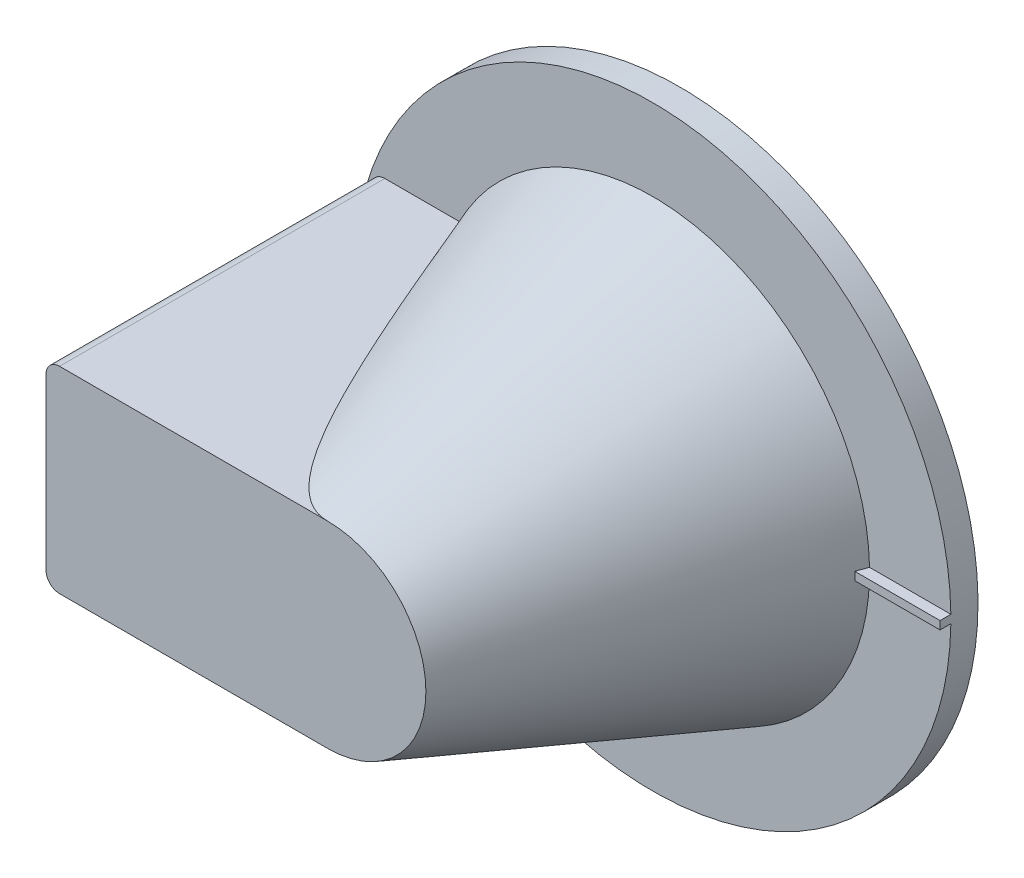
from build123d import *
from OCP.BRepFilletAPI import BRepFilletAPI_MakeChamfer

# Parameters (mm, degrees)
SKETCH1_R                 = 11
BOSS_EXTRUDE1_DEPTH       = 1
SKETCH2_R                 = 8
BOSS_EXTRUDE2_DEPTH       = 12
BOSS_EXTRUDE2_TAPER       = 20
BOSS_EXTRUDE3_REACH       = 22.273
INDICADOR_SELECCION_DEPTH = 0.4
CUT_EXTRUDE1_DEPTH        = 8
SKETCH6_R                 = 3.5
CUT_EXTRUDE2_DEPTH        = 0.6
CHAMFER1_SIZE             = 0.5
CHAMFER1_SIZE2            = 0.288675135


with BuildPart() as part:
    # Sketch1 → Boss-Extrude1 (new body)
    with BuildSketch(Plane.XY):
        Circle(SKETCH1_R)
    extrude(amount=BOSS_EXTRUDE1_DEPTH)

    # Sketch2 → Boss-Extrude2 (add)
    with BuildSketch(Plane.XY.offset(1)):
        Circle(SKETCH2_R)
    extrude(amount=BOSS_EXTRUDE2_DEPTH, taper=BOSS_EXTRUDE2_TAPER)

    # Sketch3 → Boss-Extrude3 (add, up to next)
    with BuildSketch(Plane.XY.offset(13), mode=Mode.PRIVATE) as boss_extrude3_sk1:
        with BuildLine():
            Line((0, 3.632357189), (-9.882965918, 3.632357189))
            ThreePointArc((-9.882965918, 3.632357189), (-10.236519309, 3.485910579), (-10.382965918, 3.132357189))
            Line((-10.382965918, 3.132357189), (-10.382965918, -3.132357189))
            ThreePointArc((-10.382965918, -3.132357189), (-10.236519309, -3.485910579), (-9.882965918, -3.632357189))
            Line((-9.882965918, -3.632357189), (0, -3.632357189))
            ThreePointArc((0, -3.632357189), (3.632357189, 0), (0, 3.632357189))
        make_face()
    boss_extrude3_tool1 = extrude(boss_extrude3_sk1.sketch, amount=-BOSS_EXTRUDE3_REACH, mode=Mode.PRIVATE) - part.part
    add(boss_extrude3_tool1.solids().sort_by_distance((-3.732934, 0, 13))[0])

    # Sketch4 → Indicador Seleccion (add)
    with BuildSketch(Plane.XY.offset(1)):
        with BuildLine():
            ThreePointArc((7.998593626, -0.15), (8, 0), (7.998593626, 0.15))
            Line((7.998593626, 0.15), (7.49849985, 0.15))
            ThreePointArc((7.49849985, 0.15), (7.5, 0), (7.49849985, -0.15))
            Line((7.49849985, -0.15), (7.998593626, -0.15))
        make_face()
        with BuildLine():
            ThreePointArc((11, 0), (10.999744303, 0.075001743), (10.998977225, 0.15))
            Line((10.998977225, 0.15), (7.998593626, 0.15))
            ThreePointArc((7.998593626, 0.15), (8, 0), (7.998593626, -0.15))
            Line((7.998593626, -0.15), (10.998977225, -0.15))
            ThreePointArc((10.998977225, -0.15), (10.999744303, -0.075001743), (11, 0))
        make_face()
    extrude(amount=INDICADOR_SELECCION_DEPTH)

    # Sketch5 → Cut-Extrude1 (cut)
    with BuildSketch(Plane(origin=(0, 0, 0), x_dir=(-1, 0, 0), z_dir=(0, 0, -1))):
        with BuildLine():
            ThreePointArc((-1.941278917, 1.947802907), (-2.106622219, 1.767665927), (-2.255310951, 1.573554103))
            ThreePointArc((-2.255310951, 1.573554103), (-2.663028117, 1.5375), (-2.490393303, 1.166379525))
            ThreePointArc((-2.490393303, 1.166379525), (-2.584154707, 0.940555394), (-2.657486258, 0.707295405))
            ThreePointArc((-2.657486258, 0.707295405), (-3.028283841, 0.533968146), (-2.739129502, 0.244273558))
            ThreePointArc((-2.739129502, 0.244273558), (-2.75, 0), (-2.739129502, -0.244273558))
            ThreePointArc((-2.739129502, -0.244273558), (-3.028283841, -0.533968146), (-2.657486258, -0.707295405))
            ThreePointArc((-2.657486258, -0.707295405), (-2.584154707, -0.940555394), (-2.490393303, -1.166379525))
            ThreePointArc((-2.490393303, -1.166379525), (-2.663028117, -1.5375), (-2.255310951, -1.573554103))
            ThreePointArc((-2.255310951, -1.573554103), (-2.106622219, -1.767665927), (-1.941278917, -1.947802907))
            ThreePointArc((-1.941278917, -1.947802907), (-1.9765719, -2.355586663), (-1.581111858, -2.250018954))
            ThreePointArc((-1.581111858, -2.250018954), (-1.375, -2.38156986), (-1.158017644, -2.494292512))
            ThreePointArc((-1.158017644, -2.494292512), (-1.051711941, -2.889554809), (-0.71620734, -2.655098312))
            ThreePointArc((-0.71620734, -2.655098312), (-0.477532489, -2.708221321), (-0.235082352, -2.739933628))
            ThreePointArc((-0.235082352, -2.739933628), (0, -3.075), (0.235082352, -2.739933628))
            ThreePointArc((0.235082352, -2.739933628), (0.477532489, -2.708221321), (0.71620734, -2.655098312))
            ThreePointArc((0.71620734, -2.655098312), (1.051711941, -2.889554809), (1.158017644, -2.494292512))
            ThreePointArc((1.158017644, -2.494292512), (1.375, -2.38156986), (1.581111858, -2.250018954))
            ThreePointArc((1.581111858, -2.250018954), (1.9765719, -2.355586663), (1.941278917, -1.947802907))
            ThreePointArc((1.941278917, -1.947802907), (2.106622219, -1.767665927), (2.255310951, -1.573554103))
            ThreePointArc((2.255310951, -1.573554103), (2.663028117, -1.5375), (2.490393303, -1.166379525))
            ThreePointArc((2.490393303, -1.166379525), (2.584154707, -0.940555394), (2.657486258, -0.707295405))
            ThreePointArc((2.657486258, -0.707295405), (3.028283841, -0.533968146), (2.739129502, -0.244273558))
            ThreePointArc((2.739129502, -0.244273558), (2.75, 0), (2.739129502, 0.244273558))
            ThreePointArc((2.739129502, 0.244273558), (3.028283841, 0.533968146), (2.657486258, 0.707295405))
            ThreePointArc((2.657486258, 0.707295405), (2.584154707, 0.940555394), (2.490393303, 1.166379525))
            ThreePointArc((2.490393303, 1.166379525), (2.663028117, 1.5375), (2.255310951, 1.573554103))
            ThreePointArc((2.255310951, 1.573554103), (2.106622219, 1.767665927), (1.941278917, 1.947802907))
            ThreePointArc((1.941278917, 1.947802907), (1.9765719, 2.355586663), (1.581111858, 2.250018954))
            ThreePointArc((1.581111858, 2.250018954), (1.375, 2.38156986), (1.158017644, 2.494292512))
            ThreePointArc((1.158017644, 2.494292512), (1.051711941, 2.889554809), (0.71620734, 2.655098312))
            ThreePointArc((0.71620734, 2.655098312), (0.477532489, 2.708221321), (0.235082352, 2.739933628))
            ThreePointArc((0.235082352, 2.739933628), (0, 3.075), (-0.235082352, 2.739933628))
            ThreePointArc((-0.235082352, 2.739933628), (-0.477532489, 2.708221321), (-0.71620734, 2.655098312))
            ThreePointArc((-0.71620734, 2.655098312), (-1.051711941, 2.889554809), (-1.158017644, 2.494292512))
            ThreePointArc((-1.158017644, 2.494292512), (-1.375, 2.38156986), (-1.581111858, 2.250018954))
            ThreePointArc((-1.581111858, 2.250018954), (-1.9765719, 2.355586663), (-1.941278917, 1.947802907))
        make_face()
    extrude(amount=-CUT_EXTRUDE1_DEPTH, mode=Mode.SUBTRACT)

    # Sketch6 → Cut-Extrude2 (cut)
    with BuildSketch(Plane(origin=(0, 0, 0), x_dir=(-1, 0, 0), z_dir=(0, 0, -1))):
        Circle(SKETCH6_R)
    extrude(amount=-CUT_EXTRUDE2_DEPTH, mode=Mode.SUBTRACT)

    # Chamfer1: one chamfer whose edges measure the first distance from different faces: ONE call of the kernel's chamfer builder (chamfer() names one face for all edges)
    chamfer1_edges_1 = [part.edges().sort_by_distance(p)[0] for p in [
        (2.106622219, 1.767665927, 0.6),
    ]]
    chamfer1_side_1 = [part.faces().sort_by_distance(p)[0] for p in [
        (2.106622219, 1.767665927, 4.3),
    ]]
    chamfer1_edges_2 = [part.edges().sort_by_distance(p)[0] for p in [
        (1.375, 2.38156986, 0.6),
    ]]
    chamfer1_side_2 = [part.faces().sort_by_distance(p)[0] for p in [
        (1.375, 2.38156986, 4.3),
    ]]
    chamfer1_edges_3 = [part.edges().sort_by_distance(p)[0] for p in [
        (0.477532489, 2.708221321, 0.6),
    ]]
    chamfer1_side_3 = [part.faces().sort_by_distance(p)[0] for p in [
        (0.477532489, 2.708221321, 4.3),
    ]]
    chamfer1_edges_4 = [part.edges().sort_by_distance(p)[0] for p in [
        (-0.477532489, 2.708221321, 0.6),
    ]]
    chamfer1_side_4 = [part.faces().sort_by_distance(p)[0] for p in [
        (-0.477532489, 2.708221321, 4.3),
    ]]
    chamfer1_edges_5 = [part.edges().sort_by_distance(p)[0] for p in [
        (-1.375, 2.38156986, 0.6),
    ]]
    chamfer1_side_5 = [part.faces().sort_by_distance(p)[0] for p in [
        (-1.375, 2.38156986, 4.3),
    ]]
    chamfer1_edges_6 = [part.edges().sort_by_distance(p)[0] for p in [
        (-2.106622219, 1.767665927, 0.6),
    ]]
    chamfer1_side_6 = [part.faces().sort_by_distance(p)[0] for p in [
        (-2.106622219, 1.767665927, 4.3),
    ]]
    chamfer1_edges_7 = [part.edges().sort_by_distance(p)[0] for p in [
        (-2.584154707, 0.940555394, 0.6),
    ]]
    chamfer1_side_7 = [part.faces().sort_by_distance(p)[0] for p in [
        (-2.584154707, 0.940555394, 4.3),
    ]]
    chamfer1_edges_8 = [part.edges().sort_by_distance(p)[0] for p in [
        (-2.75, 0, 0.6),
    ]]
    chamfer1_side_8 = [part.faces().sort_by_distance(p)[0] for p in [
        (-2.75, 0, 4.3),
    ]]
    chamfer1_edges_9 = [part.edges().sort_by_distance(p)[0] for p in [
        (-2.584154707, -0.940555394, 0.6),
    ]]
    chamfer1_side_9 = [part.faces().sort_by_distance(p)[0] for p in [
        (-2.584154707, -0.940555394, 4.3),
    ]]
    chamfer1_edges_10 = [part.edges().sort_by_distance(p)[0] for p in [
        (-2.106622219, -1.767665927, 0.6),
    ]]
    chamfer1_side_10 = [part.faces().sort_by_distance(p)[0] for p in [
        (-2.106622219, -1.767665927, 4.3),
    ]]
    chamfer1_edges_11 = [part.edges().sort_by_distance(p)[0] for p in [
        (-1.375, -2.38156986, 0.6),
    ]]
    chamfer1_side_11 = [part.faces().sort_by_distance(p)[0] for p in [
        (-1.375, -2.38156986, 4.3),
    ]]
    chamfer1_edges_12 = [part.edges().sort_by_distance(p)[0] for p in [
        (-0.477532489, -2.708221321, 0.6),
    ]]
    chamfer1_side_12 = [part.faces().sort_by_distance(p)[0] for p in [
        (-0.477532489, -2.708221321, 4.3),
    ]]
    chamfer1_edges_13 = [part.edges().sort_by_distance(p)[0] for p in [
        (0.477532489, -2.708221321, 0.6),
    ]]
    chamfer1_side_13 = [part.faces().sort_by_distance(p)[0] for p in [
        (0.477532489, -2.708221321, 4.3),
    ]]
    chamfer1_edges_14 = [part.edges().sort_by_distance(p)[0] for p in [
        (1.375, -2.38156986, 0.6),
    ]]
    chamfer1_side_14 = [part.faces().sort_by_distance(p)[0] for p in [
        (1.375, -2.38156986, 4.3),
    ]]
    chamfer1_edges_15 = [part.edges().sort_by_distance(p)[0] for p in [
        (2.106622219, -1.767665927, 0.6),
    ]]
    chamfer1_side_15 = [part.faces().sort_by_distance(p)[0] for p in [
        (2.106622219, -1.767665927, 4.3),
    ]]
    chamfer1_edges_16 = [part.edges().sort_by_distance(p)[0] for p in [
        (2.584154707, -0.940555394, 0.6),
    ]]
    chamfer1_side_16 = [part.faces().sort_by_distance(p)[0] for p in [
        (2.584154707, -0.940555394, 4.3),
    ]]
    chamfer1_edges_17 = [part.edges().sort_by_distance(p)[0] for p in [
        (2.75, 0, 0.6),
    ]]
    chamfer1_side_17 = [part.faces().sort_by_distance(p)[0] for p in [
        (2.75, 0, 4.3),
    ]]
    chamfer1_edges_18 = [part.edges().sort_by_distance(p)[0] for p in [
        (2.584154707, 0.940555394, 0.6),
    ]]
    chamfer1_side_18 = [part.faces().sort_by_distance(p)[0] for p in [
        (2.584154707, 0.940555394, 4.3),
    ]]
    chamfer1 = BRepFilletAPI_MakeChamfer(part.part.solid().wrapped)
    for e in chamfer1_edges_1:
        chamfer1.Add(CHAMFER1_SIZE, CHAMFER1_SIZE2, e.wrapped, chamfer1_side_1[0].wrapped)  # the first distance lies on this face
    for e in chamfer1_edges_2:
        chamfer1.Add(CHAMFER1_SIZE, CHAMFER1_SIZE2, e.wrapped, chamfer1_side_2[0].wrapped)  # the first distance lies on this face
    for e in chamfer1_edges_3:
        chamfer1.Add(CHAMFER1_SIZE, CHAMFER1_SIZE2, e.wrapped, chamfer1_side_3[0].wrapped)  # the first distance lies on this face
    for e in chamfer1_edges_4:
        chamfer1.Add(CHAMFER1_SIZE, CHAMFER1_SIZE2, e.wrapped, chamfer1_side_4[0].wrapped)  # the first distance lies on this face
    for e in chamfer1_edges_5:
        chamfer1.Add(CHAMFER1_SIZE, CHAMFER1_SIZE2, e.wrapped, chamfer1_side_5[0].wrapped)  # the first distance lies on this face
    for e in chamfer1_edges_6:
        chamfer1.Add(CHAMFER1_SIZE, CHAMFER1_SIZE2, e.wrapped, chamfer1_side_6[0].wrapped)  # the first distance lies on this face
    for e in chamfer1_edges_7:
        chamfer1.Add(CHAMFER1_SIZE, CHAMFER1_SIZE2, e.wrapped, chamfer1_side_7[0].wrapped)  # the first distance lies on this face
    for e in chamfer1_edges_8:
        chamfer1.Add(CHAMFER1_SIZE, CHAMFER1_SIZE2, e.wrapped, chamfer1_side_8[0].wrapped)  # the first distance lies on this face
    for e in chamfer1_edges_9:
        chamfer1.Add(CHAMFER1_SIZE, CHAMFER1_SIZE2, e.wrapped, chamfer1_side_9[0].wrapped)  # the first distance lies on this face
    for e in chamfer1_edges_10:
        chamfer1.Add(CHAMFER1_SIZE, CHAMFER1_SIZE2, e.wrapped, chamfer1_side_10[0].wrapped)  # the first distance lies on this face
    for e in chamfer1_edges_11:
        chamfer1.Add(CHAMFER1_SIZE, CHAMFER1_SIZE2, e.wrapped, chamfer1_side_11[0].wrapped)  # the first distance lies on this face
    for e in chamfer1_edges_12:
        chamfer1.Add(CHAMFER1_SIZE, CHAMFER1_SIZE2, e.wrapped, chamfer1_side_12[0].wrapped)  # the first distance lies on this face
    for e in chamfer1_edges_13:
        chamfer1.Add(CHAMFER1_SIZE, CHAMFER1_SIZE2, e.wrapped, chamfer1_side_13[0].wrapped)  # the first distance lies on this face
    for e in chamfer1_edges_14:
        chamfer1.Add(CHAMFER1_SIZE, CHAMFER1_SIZE2, e.wrapped, chamfer1_side_14[0].wrapped)  # the first distance lies on this face
    for e in chamfer1_edges_15:
        chamfer1.Add(CHAMFER1_SIZE, CHAMFER1_SIZE2, e.wrapped, chamfer1_side_15[0].wrapped)  # the first distance lies on this face
    for e in chamfer1_edges_16:
        chamfer1.Add(CHAMFER1_SIZE, CHAMFER1_SIZE2, e.wrapped, chamfer1_side_16[0].wrapped)  # the first distance lies on this face
    for e in chamfer1_edges_17:
        chamfer1.Add(CHAMFER1_SIZE, CHAMFER1_SIZE2, e.wrapped, chamfer1_side_17[0].wrapped)  # the first distance lies on this face
    for e in chamfer1_edges_18:
        chamfer1.Add(CHAMFER1_SIZE, CHAMFER1_SIZE2, e.wrapped, chamfer1_side_18[0].wrapped)  # the first distance lies on this face
    add(Compound.cast(chamfer1.Shape()), mode=Mode.REPLACE)


solid = part.part
